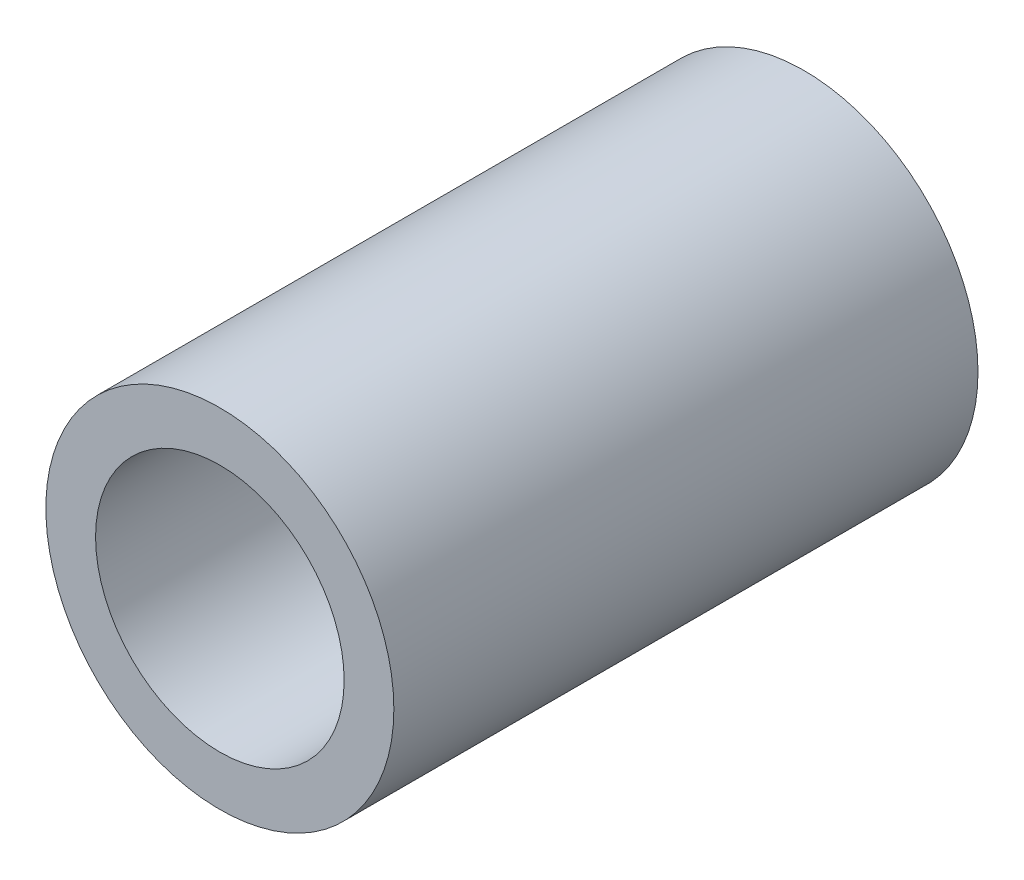
from build123d import *

# Parameters (mm, degrees)
SKETCH_1_R      = 7
SKETCH_1_R_2    = 5
EXTRUDE_1_DEPTH = 23.5


with BuildPart() as part:
    # 草图1 → 凸台-拉伸1 (new body)
    with BuildSketch(Plane.XY):
        Circle(SKETCH_1_R)
        Circle(SKETCH_1_R_2, mode=Mode.SUBTRACT)
    extrude(amount=EXTRUDE_1_DEPTH)


solid = part.part
